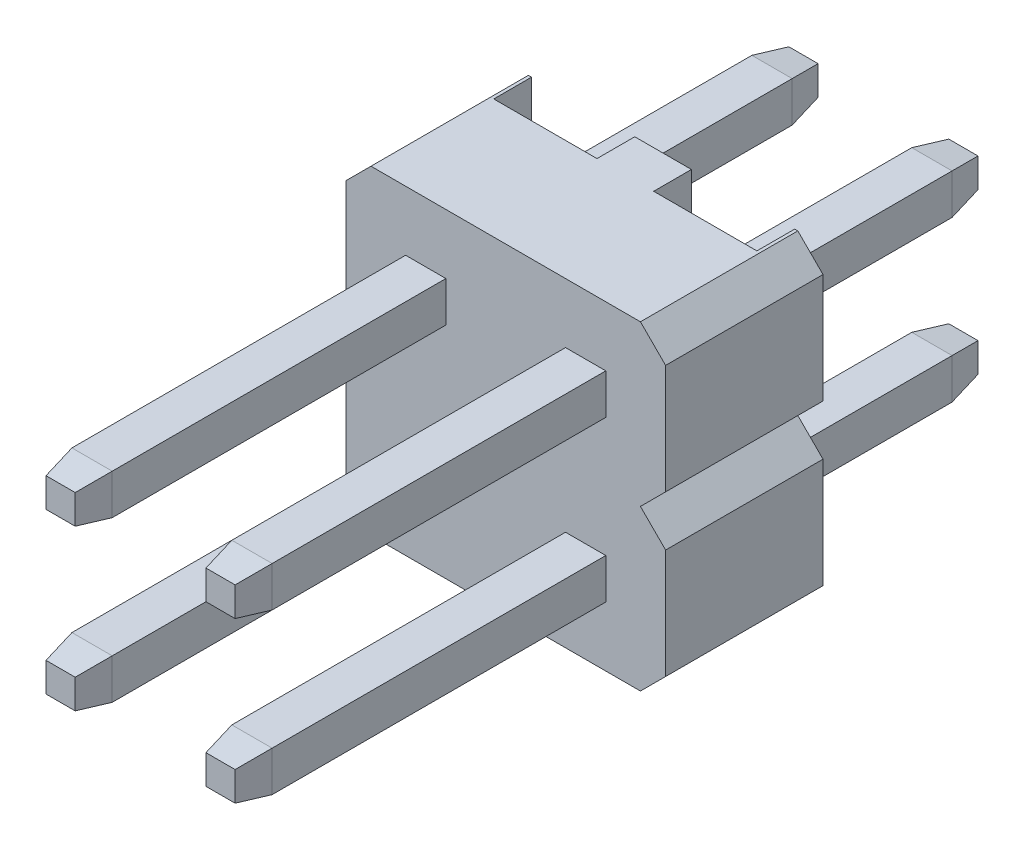
from build123d import *

# Parameters (mm, degrees)
SKETCH1_W                     = 0.64
SKETCH1_H                     = 0.64
BOSS_EXTRUDE1_DEPTH           = 5.3
BOSS_EXTRUDE1_2_DEPTH         = 5.3
BOSS_EXTRUDE1_3_DEPTH         = 5.3
BOSS_EXTRUDE1_4_DEPTH         = 5.3
SKETCH2_W                     = 0.64
SKETCH2_H                     = 0.64
BOSS_EXTRUDE2_DEPTH           = 0.5
BOSS_EXTRUDE2_DRAFT           = 10
BOSS_EXTRUDE2_PROFILE_2_DEPTH = 0.5
BOSS_EXTRUDE2_PROFILE_2_DRAFT = 10
BOSS_EXTRUDE2_PROFILE_3_DEPTH = 0.5
BOSS_EXTRUDE2_PROFILE_3_DRAFT = 10
BOSS_EXTRUDE2_PROFILE_4_DEPTH = 0.5
BOSS_EXTRUDE2_PROFILE_4_DRAFT = 10
BOSS_EXTRUDE3_DEPTH           = 2.5
SKETCH5_W                     = 1.64
SKETCH5_H                     = 5.08
CUT_EXTRUDE1_DEPTH            = 0.6
CUT_EXTRUDE3_DEPTH            = 7.822257691
SKETCH8_W                     = 0.64
SKETCH8_H                     = 0.64
BOSS_EXTRUDE4_DEPTH           = 3.6
BOSS_EXTRUDE4_2_DEPTH         = 3.6
BOSS_EXTRUDE4_3_DEPTH         = 3.6
BOSS_EXTRUDE4_4_DEPTH         = 3.6
SKETCH9_W                     = 0.64
SKETCH9_H                     = 0.64
BOSS_EXTRUDE5_DEPTH           = 0.5
BOSS_EXTRUDE5_DRAFT           = 10
BOSS_EXTRUDE5_PROFILE_2_DEPTH = 0.5
BOSS_EXTRUDE5_PROFILE_2_DRAFT = 10
BOSS_EXTRUDE5_PROFILE_3_DEPTH = 0.5
BOSS_EXTRUDE5_PROFILE_3_DRAFT = 10
BOSS_EXTRUDE5_PROFILE_4_DEPTH = 0.5
BOSS_EXTRUDE5_PROFILE_4_DRAFT = 10


with BuildPart() as part:
    # Sketch1 → Boss-Extrude1 (new body)
    with BuildSketch(Plane.XY):
        with Locations((-1.27, 1.27)):
            Rectangle(SKETCH1_W, SKETCH1_H)
    extrude(amount=BOSS_EXTRUDE1_DEPTH)


with BuildPart() as body_2:
    # Sketch1 → Boss-Extrude1 2 (new body)
    with BuildSketch(Plane.XY):
        with Locations((-1.27, -1.27)):
            Rectangle(SKETCH1_W, SKETCH1_H)
    extrude(amount=BOSS_EXTRUDE1_2_DEPTH)


with BuildPart() as body_3:
    # Sketch1 → Boss-Extrude1 3 (new body)
    with BuildSketch(Plane.XY):
        with Locations((1.27, 1.27)):
            Rectangle(SKETCH1_W, SKETCH1_H)
    extrude(amount=BOSS_EXTRUDE1_3_DEPTH)


with BuildPart() as body_4:
    # Sketch1 → Boss-Extrude1 4 (new body)
    with BuildSketch(Plane.XY):
        with Locations((1.27, -1.27)):
            Rectangle(SKETCH1_W, SKETCH1_H)
    extrude(amount=BOSS_EXTRUDE1_4_DEPTH)


with BuildPart() as boss_extrude2_tool:
    # Sketch2 → Boss-Extrude2 (with draft: the straight prism first)
    with BuildSketch(Plane.XY.offset(5.3)):
        with Locations((-1.27, -1.27)):
            Rectangle(SKETCH2_W, SKETCH2_H)
    extrude(amount=BOSS_EXTRUDE2_DEPTH)
    # Boss-Extrude2: the draft: its side faces are tilted about the plane it starts from
    boss_extrude2_sides = [boss_extrude2_tool.faces().sort_by_distance(p)[0] for p in [
        (-1.59, -1.27, 5.55),
        (-1.27, -1.59, 5.55),
        (-0.95, -1.27, 5.55),
        (-1.27, -0.95, 5.55),
    ]]
    draft(boss_extrude2_sides, Plane.XY.offset(5.3), BOSS_EXTRUDE2_DRAFT)


with BuildPart() as part_1:
    add(part.part)

    # Boss-Extrude2: add boss_extrude2_tool
    add(boss_extrude2_tool.part)

    add(body_2.part)  # Boss-Extrude2 merges body 2

    add(body_3.part)  # Boss-Extrude2 merges body 3

    add(body_4.part)  # Boss-Extrude2 merges body 4


with BuildPart() as boss_extrude2_profile_2_tool:
    # Sketch2 → Boss-Extrude2 profile 2 (with draft: the straight prism first)
    with BuildSketch(Plane.XY.offset(5.3)):
        with Locations((-1.27, 1.27)):
            Rectangle(SKETCH2_W, SKETCH2_H)
    extrude(amount=BOSS_EXTRUDE2_PROFILE_2_DEPTH)
    # Boss-Extrude2 profile 2: the draft: its side faces are tilted about the plane it starts from
    boss_extrude2_profile_2_sides = [boss_extrude2_profile_2_tool.faces().sort_by_distance(p)[0] for p in [
        (-1.59, 1.27, 5.55),
        (-1.27, 0.95, 5.55),
        (-0.95, 1.27, 5.55),
        (-1.27, 1.59, 5.55),
    ]]
    draft(boss_extrude2_profile_2_sides, Plane.XY.offset(5.3), BOSS_EXTRUDE2_PROFILE_2_DRAFT)


with BuildPart() as part_2:
    add(part_1.part)

    # Boss-Extrude2 profile 2: add boss_extrude2_profile_2_tool
    add(boss_extrude2_profile_2_tool.part)


with BuildPart() as boss_extrude2_profile_3_tool:
    # Sketch2 → Boss-Extrude2 profile 3 (with draft: the straight prism first)
    with BuildSketch(Plane.XY.offset(5.3)):
        with Locations((1.27, -1.27)):
            Rectangle(SKETCH2_W, SKETCH2_H)
    extrude(amount=BOSS_EXTRUDE2_PROFILE_3_DEPTH)
    # Boss-Extrude2 profile 3: the draft: its side faces are tilted about the plane it starts from
    boss_extrude2_profile_3_sides = [boss_extrude2_profile_3_tool.faces().sort_by_distance(p)[0] for p in [
        (1.59, -1.27, 5.55),
        (1.27, -0.95, 5.55),
        (0.95, -1.27, 5.55),
        (1.27, -1.59, 5.55),
    ]]
    draft(boss_extrude2_profile_3_sides, Plane.XY.offset(5.3), BOSS_EXTRUDE2_PROFILE_3_DRAFT)


with BuildPart() as part_3:
    add(part_2.part)

    # Boss-Extrude2 profile 3: add boss_extrude2_profile_3_tool
    add(boss_extrude2_profile_3_tool.part)


with BuildPart() as boss_extrude2_profile_4_tool:
    # Sketch2 → Boss-Extrude2 profile 4 (with draft: the straight prism first)
    with BuildSketch(Plane.XY.offset(5.3)):
        with Locations((1.27, 1.27)):
            Rectangle(SKETCH2_W, SKETCH2_H)
    extrude(amount=BOSS_EXTRUDE2_PROFILE_4_DEPTH)
    # Boss-Extrude2 profile 4: the draft: its side faces are tilted about the plane it starts from
    boss_extrude2_profile_4_sides = [boss_extrude2_profile_4_tool.faces().sort_by_distance(p)[0] for p in [
        (1.59, 1.27, 5.55),
        (1.27, 1.59, 5.55),
        (0.95, 1.27, 5.55),
        (1.27, 0.95, 5.55),
    ]]
    draft(boss_extrude2_profile_4_sides, Plane.XY.offset(5.3), BOSS_EXTRUDE2_PROFILE_4_DRAFT)


with BuildPart() as part_4:
    add(part_3.part)

    # Boss-Extrude2 profile 4: add boss_extrude2_profile_4_tool
    add(boss_extrude2_profile_4_tool.part)


with BuildPart() as body_2_2:
    # Sketch3 → Boss-Extrude3 (new body)
    with BuildSketch(Plane.XY):
        Polygon((-2.14, 2.54), (2.14, 2.54), (2.54, 2.14), (2.54, -2.14), (2.14, -2.54), (-2.14, -2.54), (-2.54, -2.14), (-2.54, 2.14), align=None)
    extrude(amount=-BOSS_EXTRUDE3_DEPTH)

    # Sketch5 → Cut-Extrude1 (cut)
    with BuildSketch(Plane(origin=(0, 0, -2.5), x_dir=(-1, 0, 0), z_dir=(0, 0, -1))):
        with Locations((-1.27, 0)):
            Rectangle(SKETCH5_W, SKETCH5_H)
        with Locations((1.27, 0)):
            Rectangle(SKETCH5_W, SKETCH5_H)
    extrude(amount=-CUT_EXTRUDE1_DEPTH, mode=Mode.SUBTRACT)

    # Sketch7 → Cut-Extrude3 (cut, through all)
    with BuildSketch(Plane.XY):
        Polygon((2.54, 0), (2.54, 0.4), (2.14, 0), align=None)
        Polygon((2.54, 0), (2.14, 0), (2.54, -0.4), align=None)
        Polygon((-2.54, 0), (-2.54, -0.4), (-2.14, 0), align=None)
        Polygon((-2.54, 0.4), (-2.54, 0), (-2.14, 0), align=None)
    extrude(amount=-CUT_EXTRUDE3_DEPTH, mode=Mode.SUBTRACT)


with BuildPart() as body_3_2:
    # Sketch8 → Boss-Extrude4 (new body)
    with BuildSketch(Plane(origin=(0, 0, -1.9), x_dir=(-1, 0, 0), z_dir=(0, 0, -1))):
        with Locations((1.27, -1.27)):
            Rectangle(SKETCH8_W, SKETCH8_H)
    extrude(amount=BOSS_EXTRUDE4_DEPTH)


with BuildPart() as body_4_2:
    # Sketch8 → Boss-Extrude4 2 (new body)
    with BuildSketch(Plane(origin=(0, 0, -1.9), x_dir=(-1, 0, 0), z_dir=(0, 0, -1))):
        with Locations((1.27, 1.27)):
            Rectangle(SKETCH8_W, SKETCH8_H)
    extrude(amount=BOSS_EXTRUDE4_2_DEPTH)


with BuildPart() as body_5:
    # Sketch8 → Boss-Extrude4 3 (new body)
    with BuildSketch(Plane(origin=(0, 0, -1.9), x_dir=(-1, 0, 0), z_dir=(0, 0, -1))):
        with Locations((-1.27, 1.27)):
            Rectangle(SKETCH8_W, SKETCH8_H)
    extrude(amount=BOSS_EXTRUDE4_3_DEPTH)


with BuildPart() as body_6:
    # Sketch8 → Boss-Extrude4 4 (new body)
    with BuildSketch(Plane(origin=(0, 0, -1.9), x_dir=(-1, 0, 0), z_dir=(0, 0, -1))):
        with Locations((-1.27, -1.27)):
            Rectangle(SKETCH8_W, SKETCH8_H)
    extrude(amount=BOSS_EXTRUDE4_4_DEPTH)


with BuildPart() as boss_extrude5_tool:
    # Sketch9 → Boss-Extrude5 (with draft: the straight prism first)
    with BuildSketch(Plane(origin=(0, 0, -5.5), x_dir=(-1, 0, 0), z_dir=(0, 0, -1))):
        with Locations((1.27, 1.27)):
            Rectangle(SKETCH9_W, SKETCH9_H)
    extrude(amount=BOSS_EXTRUDE5_DEPTH)
    # Boss-Extrude5: the draft: its side faces are tilted about the plane it starts from
    boss_extrude5_sides = [boss_extrude5_tool.faces().sort_by_distance(p)[0] for p in [
        (-0.95, 1.27, -5.75),
        (-1.27, 0.95, -5.75),
        (-1.59, 1.27, -5.75),
        (-1.27, 1.59, -5.75),
    ]]
    draft(boss_extrude5_sides, Plane(origin=(0, 0, -5.5), x_dir=(-1, 0, 0), z_dir=(0, 0, -1)), BOSS_EXTRUDE5_DRAFT)


with BuildPart() as body_4_2_1:
    add(body_4_2.part)

    # Boss-Extrude5: add boss_extrude5_tool
    add(boss_extrude5_tool.part)

    add(body_3_2.part)  # Boss-Extrude5 merges body 3 2

    add(body_6.part)  # Boss-Extrude5 merges body 6

    add(body_5.part)  # Boss-Extrude5 merges body 5


with BuildPart() as boss_extrude5_profile_2_tool:
    # Sketch9 → Boss-Extrude5 profile 2 (with draft: the straight prism first)
    with BuildSketch(Plane(origin=(0, 0, -5.5), x_dir=(-1, 0, 0), z_dir=(0, 0, -1))):
        with Locations((1.27, -1.27)):
            Rectangle(SKETCH9_W, SKETCH9_H)
    extrude(amount=BOSS_EXTRUDE5_PROFILE_2_DEPTH)
    # Boss-Extrude5 profile 2: the draft: its side faces are tilted about the plane it starts from
    boss_extrude5_profile_2_sides = [boss_extrude5_profile_2_tool.faces().sort_by_distance(p)[0] for p in [
        (-1.59, -1.27, -5.75),
        (-1.27, -0.95, -5.75),
        (-0.95, -1.27, -5.75),
        (-1.27, -1.59, -5.75),
    ]]
    draft(boss_extrude5_profile_2_sides, Plane(origin=(0, 0, -5.5), x_dir=(-1, 0, 0), z_dir=(0, 0, -1)), BOSS_EXTRUDE5_PROFILE_2_DRAFT)


with BuildPart() as body_4_2_2:
    add(body_4_2_1.part)

    # Boss-Extrude5 profile 2: add boss_extrude5_profile_2_tool
    add(boss_extrude5_profile_2_tool.part)


with BuildPart() as boss_extrude5_profile_3_tool:
    # Sketch9 → Boss-Extrude5 profile 3 (with draft: the straight prism first)
    with BuildSketch(Plane(origin=(0, 0, -5.5), x_dir=(-1, 0, 0), z_dir=(0, 0, -1))):
        with Locations((-1.27, -1.27)):
            Rectangle(SKETCH9_W, SKETCH9_H)
    extrude(amount=BOSS_EXTRUDE5_PROFILE_3_DEPTH)
    # Boss-Extrude5 profile 3: the draft: its side faces are tilted about the plane it starts from
    boss_extrude5_profile_3_sides = [boss_extrude5_profile_3_tool.faces().sort_by_distance(p)[0] for p in [
        (1.59, -1.27, -5.75),
        (1.27, -1.59, -5.75),
        (0.95, -1.27, -5.75),
        (1.27, -0.95, -5.75),
    ]]
    draft(boss_extrude5_profile_3_sides, Plane(origin=(0, 0, -5.5), x_dir=(-1, 0, 0), z_dir=(0, 0, -1)), BOSS_EXTRUDE5_PROFILE_3_DRAFT)


with BuildPart() as body_4_2_3:
    add(body_4_2_2.part)

    # Boss-Extrude5 profile 3: add boss_extrude5_profile_3_tool
    add(boss_extrude5_profile_3_tool.part)


with BuildPart() as boss_extrude5_profile_4_tool:
    # Sketch9 → Boss-Extrude5 profile 4 (with draft: the straight prism first)
    with BuildSketch(Plane(origin=(0, 0, -5.5), x_dir=(-1, 0, 0), z_dir=(0, 0, -1))):
        with Locations((-1.27, 1.27)):
            Rectangle(SKETCH9_W, SKETCH9_H)
    extrude(amount=BOSS_EXTRUDE5_PROFILE_4_DEPTH)
    # Boss-Extrude5 profile 4: the draft: its side faces are tilted about the plane it starts from
    boss_extrude5_profile_4_sides = [boss_extrude5_profile_4_tool.faces().sort_by_distance(p)[0] for p in [
        (0.95, 1.27, -5.75),
        (1.27, 1.59, -5.75),
        (1.59, 1.27, -5.75),
        (1.27, 0.95, -5.75),
    ]]
    draft(boss_extrude5_profile_4_sides, Plane(origin=(0, 0, -5.5), x_dir=(-1, 0, 0), z_dir=(0, 0, -1)), BOSS_EXTRUDE5_PROFILE_4_DRAFT)


with BuildPart() as body_4_2_4:
    add(body_4_2_3.part)

    # Boss-Extrude5 profile 4: add boss_extrude5_profile_4_tool
    add(boss_extrude5_profile_4_tool.part)


solid = Compound([part_4.part, body_2_2.part, body_4_2_4.part])
